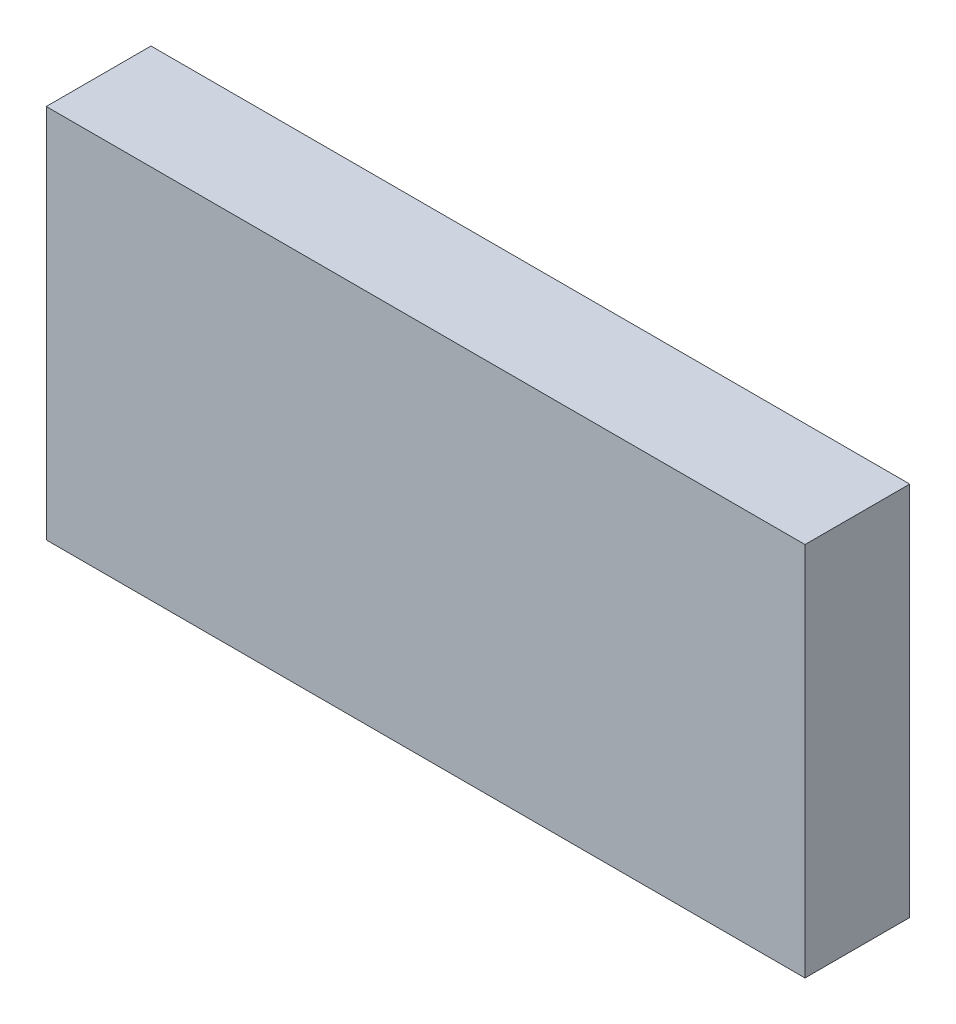
from build123d import *

# Parameters (mm, degrees)
SKETCH1_W               = 18.3999886
SKETCH1_H               = 9.1032076
COMPONENT_OUTLINE_DEPTH = 2.54


with BuildPart() as part:
    # Sketch1 → Component_Outline (new body)
    with BuildSketch(Plane.XY):
        with Locations((9.0999945, 4.477004)):
            Rectangle(SKETCH1_W, SKETCH1_H)
    extrude(amount=COMPONENT_OUTLINE_DEPTH)


solid = part.part
